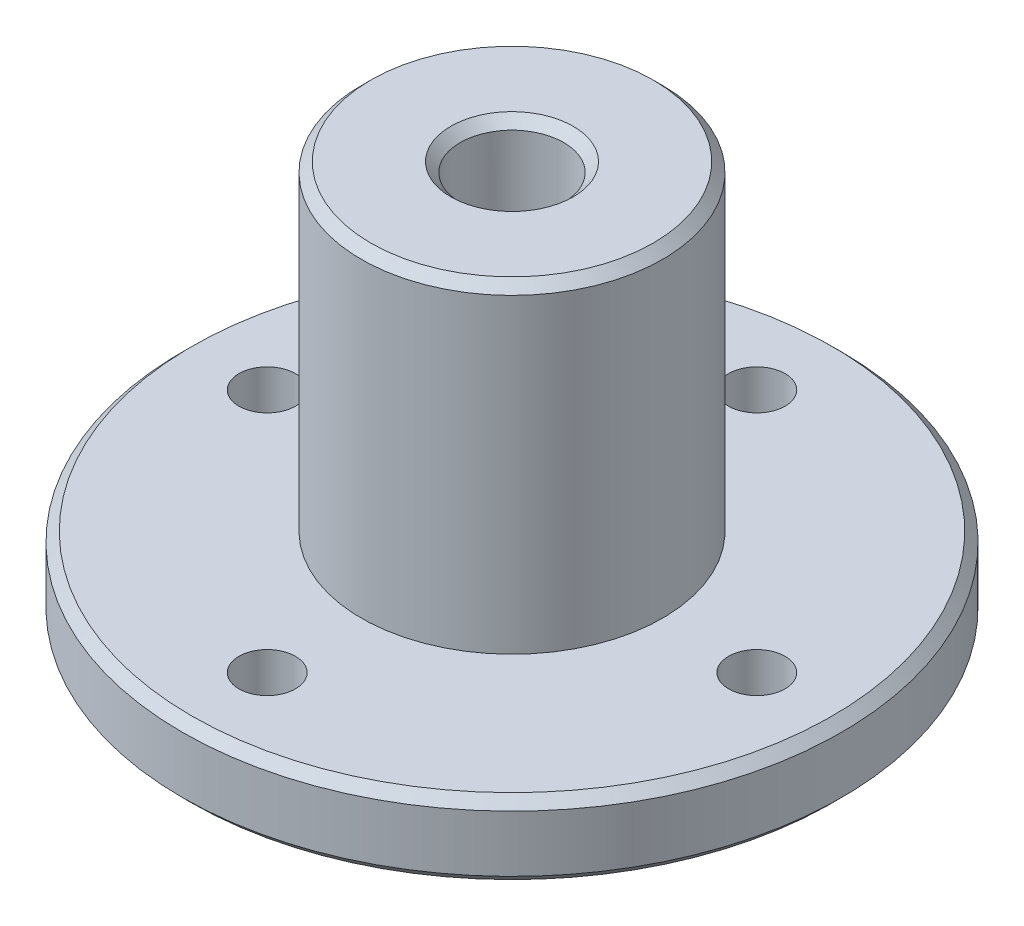
from build123d import *

# Parameters (mm, degrees)
SKETCH1_R           = 17.5
BOSS_EXTRUDE1_DEPTH = 4
SKETCH1_3_R         = 8
SKETCH1_3_R_2       = 2.75
BOSS_EXTRUDE2_DEPTH = 4
SKETCH1_4_R         = 8
SKETCH1_4_R_2       = 2.75
BOSS_EXTRUDE3_DEPTH = 21
SKETCH2_R           = 5.5
CUT_EXTRUDE1_DEPTH  = 21
SKETCH4_R           = 6
CUT_EXTRUDE2_DEPTH  = 1.1
SKETCH5_R           = 1.5
CUT_EXTRUDE3_DEPTH  = 21.1
CHAMFER1_SIZE       = 0.5


with BuildPart() as part:
    # Sketch1 → Boss-Extrude1 (new body)
    with BuildSketch(Plane(origin=(0, 0, 0), x_dir=(1, 0, 0), z_dir=(0, 1, 0))):
        Circle(SKETCH1_R)
    extrude(amount=BOSS_EXTRUDE1_DEPTH)

    # Sketch1<3> → Boss-Extrude2 (add)
    with BuildSketch(Plane(origin=(0, 0, 0), x_dir=(1, 0, 0), z_dir=(0, 1, 0))):
        Circle(SKETCH1_3_R)
        Circle(SKETCH1_3_R_2, mode=Mode.SUBTRACT)
    extrude(amount=BOSS_EXTRUDE2_DEPTH)

    # Sketch1<4> → Boss-Extrude3 (add)
    with BuildSketch(Plane(origin=(0, 0, 0), x_dir=(1, 0, 0), z_dir=(0, 1, 0))):
        Circle(SKETCH1_4_R)
        Circle(SKETCH1_4_R_2, mode=Mode.SUBTRACT)
    extrude(amount=BOSS_EXTRUDE3_DEPTH)

    # Sketch2 → Cut-Extrude1 (cut)
    with BuildSketch(Plane(origin=(0, 16, 0), x_dir=(1, 0, 0), z_dir=(0, 1, 0))):
        Circle(SKETCH2_R)
    extrude(amount=-CUT_EXTRUDE1_DEPTH, mode=Mode.SUBTRACT)

    # Sketch4 → Cut-Extrude2 (cut)
    with BuildSketch(Plane(origin=(0, 13.1, 0), x_dir=(1, 0, 0), z_dir=(0, 1, 0))):
        Circle(SKETCH4_R)
    extrude(amount=-CUT_EXTRUDE2_DEPTH, mode=Mode.SUBTRACT)

    # Sketch5 → Cut-Extrude3 (cut)
    with BuildSketch(Plane(origin=(0, 4, 0), x_dir=(1, 0, 0), z_dir=(0, 1, 0))):
        with Locations((0, 13)):
            Circle(SKETCH5_R)
        with Locations((13, 0)):
            Circle(SKETCH5_R)
        with Locations((0, -13)):
            Circle(SKETCH5_R)
        with Locations((-13, 0)):
            Circle(SKETCH5_R)
    extrude(amount=-CUT_EXTRUDE3_DEPTH, mode=Mode.SUBTRACT)

    # Chamfer1
    chamfer1_edges = [part.edges().sort_by_distance(p)[0] for p in [
        (-17.5, 0, 0),
        (-5.5, 0, 0),
        (-14.5, 0, 0),
        (-1.5, 0, 13),
        (11.5, 0, 0),
        (-1.5, 0, -13),
        (-2.75, 21, 0),
        (-8, 21, 0),
        (-17.5, 4, 0),
    ]]
    chamfer(chamfer1_edges, length=CHAMFER1_SIZE)


solid = part.part
